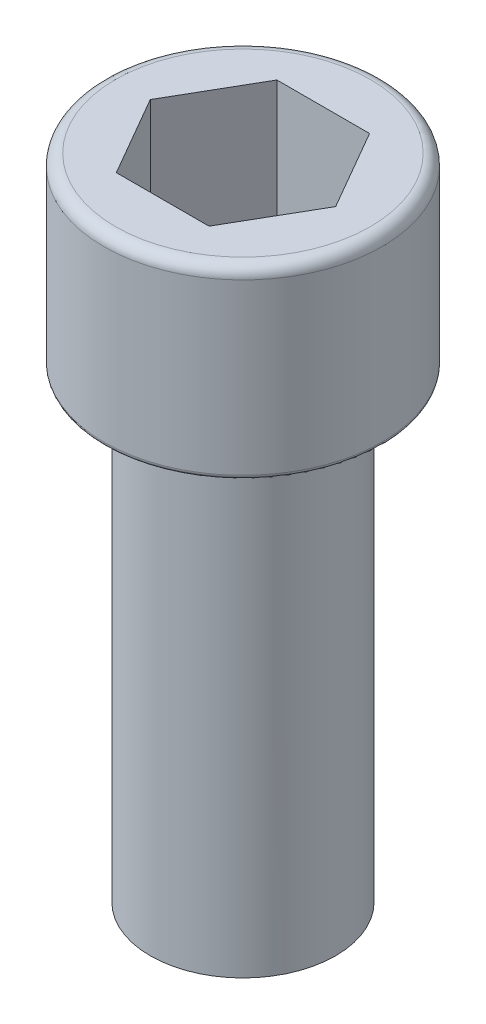
from build123d import *

# Parameters (mm, degrees)
SKETCH1_R           = 3
BOSS_EXTRUDE1_DEPTH = 4
FILLET1_R           = 0.25
CUT_EXTRUDE1_DEPTH  = 3
FILLET2_R           = 0.1
SKETCH3_R           = 2
BOSS_EXTRUDE2_DEPTH = 10


with BuildPart() as part:
    # Sketch1 → Boss-Extrude1 (new body)
    with BuildSketch(Plane(origin=(0, 0, 0), x_dir=(1, 0, 0), z_dir=(0, 1, 0))):
        with Locations(Location((0, 0, 0), (0, 0, 270))):
            Circle(SKETCH1_R)
    extrude(amount=BOSS_EXTRUDE1_DEPTH)

    # Fillet1
    fillet1_edges = [part.edges().sort_by_distance(p)[0] for p in [
        (0, 4, -3),
    ]]
    fillet(fillet1_edges, radius=FILLET1_R)

    # Sketch2 → Cut-Extrude1 (cut)
    with BuildSketch(Plane(origin=(0, 4, 0), x_dir=(1, 0, 0), z_dir=(0, 1, 0))):
        Polygon((2, 0), (1, 1.732050808), (-1, 1.732050808), (-2, 0), (-1, -1.732050808), (1, -1.732050808), align=None)
    extrude(amount=-CUT_EXTRUDE1_DEPTH, mode=Mode.SUBTRACT)

    # Fillet2
    fillet2_edges = [part.edges().sort_by_distance(p)[0] for p in [
        (0, 0, -3),
    ]]
    fillet(fillet2_edges, radius=FILLET2_R)

    # Sketch3 → Boss-Extrude2 (add)
    with BuildSketch(Plane.XZ):
        with Locations(Location((0, 0, 0), (0, 0, 90))):
            Circle(SKETCH3_R)
    extrude(amount=BOSS_EXTRUDE2_DEPTH)


solid = part.part
